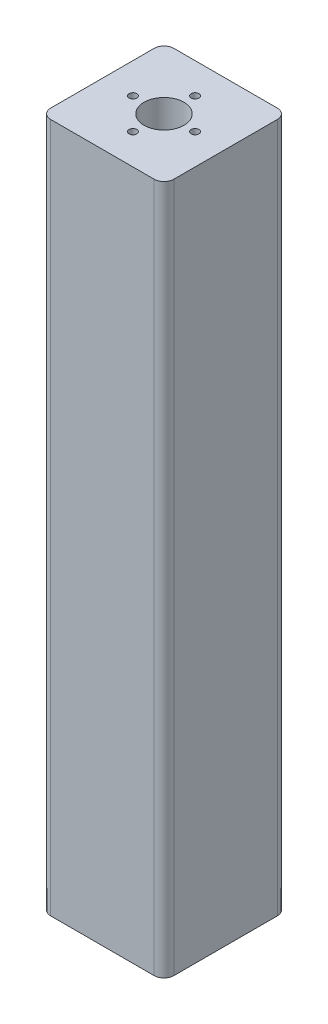
from build123d import *

# Parameters (mm, degrees)
SKETCH1_W           = 31.75
SKETCH1_H           = 31.75
BOSS_EXTRUDE1_DEPTH = 177.8
SKETCH2_R           = 1
CUT_EXTRUDE1_DEPTH  = 38.1
FILLET1_R           = 2.54
SKETCH3_R           = 5.15
CUT_EXTRUDE2_DEPTH  = 165.1
SKETCH4_R           = 1
CUT_EXTRUDE3_DEPTH  = 180.211805554


with BuildPart() as part:
    # Sketch1 → Boss-Extrude1 (new body)
    with BuildSketch(Plane(origin=(0, 0, 0), x_dir=(1, 0, 0), z_dir=(0, 1, 0))):
        Rectangle(SKETCH1_W, SKETCH1_H)
    extrude(amount=BOSS_EXTRUDE1_DEPTH)

    # Sketch2 → Cut-Extrude1 (cut)
    with BuildSketch(Plane(origin=(0, 177.8, 0), x_dir=(1, 0, 0), z_dir=(0, 1, 0))):
        with Locations(Location((0, 8, 0), (0, 0, 270))):
            Circle(SKETCH2_R)
        with Locations(Location((0, -8, 0), (0, 0, 270))):
            Circle(SKETCH2_R)
        with Locations(Location((-8, 0, 0), (0, 0, 270))):
            Circle(SKETCH2_R)
        with Locations(Location((8, 0, 0), (0, 0, 270))):
            Circle(SKETCH2_R)
    extrude(amount=-CUT_EXTRUDE1_DEPTH, mode=Mode.SUBTRACT)

    # Fillet1
    fillet1_edges = [part.edges().sort_by_distance(p)[0] for p in [
        (-15.875, 88.9, -15.875),
        (15.875, 88.9, -15.875),
        (15.875, 88.9, 15.875),
        (-15.875, 88.9, 15.875),
    ]]
    fillet(fillet1_edges, radius=FILLET1_R)

    # Sketch3 → Cut-Extrude2 (cut)
    with BuildSketch(Plane(origin=(0, 177.8, 0), x_dir=(1, 0, 0), z_dir=(0, 1, 0))):
        with Locations(Location((0, 0, 0), (0, 0, 270))):
            Circle(SKETCH3_R)
    extrude(amount=-CUT_EXTRUDE2_DEPTH, mode=Mode.SUBTRACT)

    # Sketch4 → Cut-Extrude3 (cut, through all)
    with BuildSketch(Plane.XZ):
        with Locations(Location((0, 0, 0), (0, 0, 270))):
            Circle(SKETCH4_R)
    extrude(amount=-CUT_EXTRUDE3_DEPTH, mode=Mode.SUBTRACT)


solid = part.part
